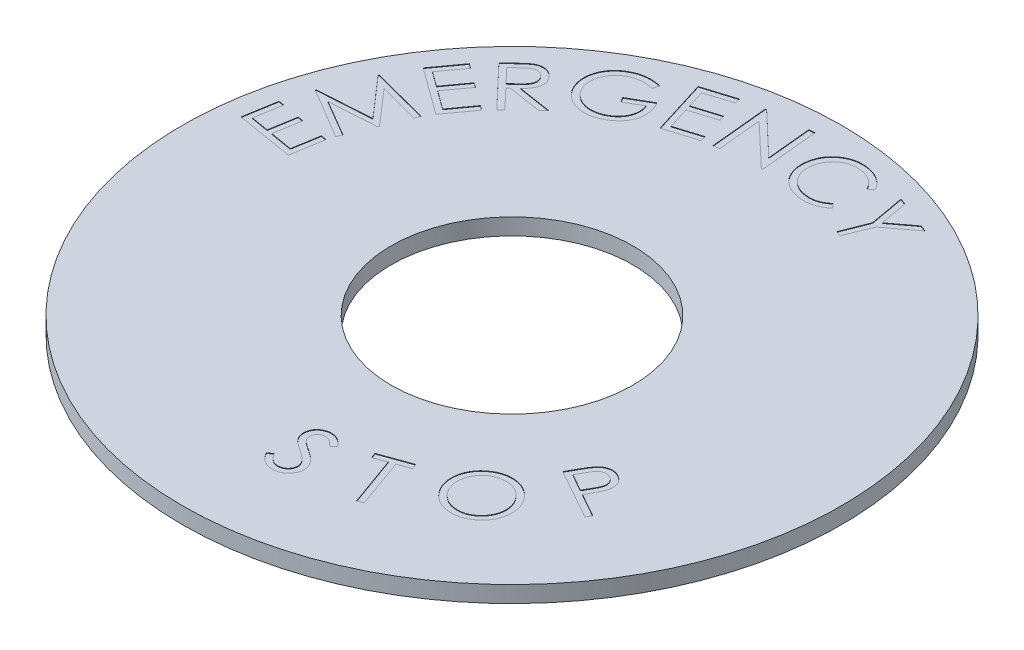
from build123d import *

# Parameters (mm, degrees)
SKETCH1_R           = 30
SKETCH1_R_2         = 11
BOSS_EXTRUDE1_DEPTH = 1.5
CUT_EXTRUDE1_DEPTH  = 0.05


with BuildPart() as part:
    # Sketch1 → Boss-Extrude1 (new body)
    with BuildSketch(Plane(origin=(0, 0, 0), x_dir=(1, 0, 0), z_dir=(0, 1, 0))):
        with Locations(Location((0, 0, 0), (0, 0, 270))):
            Circle(SKETCH1_R)
        with Locations(Location((0, 0, 0), (0, 0, 270))):
            Circle(SKETCH1_R_2, mode=Mode.SUBTRACT)
    extrude(amount=BOSS_EXTRUDE1_DEPTH)

    # Sketch2 → Cut-Extrude1 (cut)
    # profile 1 of 13: a face of its own
    with BuildSketch(Plane(origin=(0, 1.5, 0), x_dir=(1, 0, 0), z_dir=(0, 1, 0))):
        Polygon((8.532135657, 26.883621153), (9.095011258, 26.661014983), (9.545523745, 24.159345646), (11.565939744, 25.682607865), (12.129875374, 25.458941666), (9.578384655, 23.526508106), (8.656159094, 21.197623557), (8.175965785, 21.387368816), (9.098191346, 23.716253365), align=None)
    # profile 2 of 13: a face of its own
    with BuildSketch(Plane(origin=(0, 1.5, 0), x_dir=(1, 0, 0), z_dir=(0, 1, 0))):
        with BuildLine():
            Line((6.644591509, 26.400331876), (6.186658817, 26.146984854))
            add(Edge.make_bspline(
                [(6.186658817, 26.146984854), (6.163390178, 26.187509824), (6.117377826, 26.267645551), (6.041641982, 26.382926031), (5.960137749, 26.491876863), (5.873153275, 26.594978897), (5.780778697, 26.691274944), (5.683755691, 26.782219188), (5.581096008, 26.866852002), (5.47293275, 26.945164014), (5.360349437, 27.017265028), (5.243909582, 27.083493718), (5.122425962, 27.14085005), (4.998555558, 27.195482159), (4.868752237, 27.238459204), (4.73656702, 27.278521762), (4.599847021, 27.31045278), (4.506956954, 27.326223552), (4.459870956, 27.33421776)],
                knots=[0, 0, 0, 0, 1.031399129, 2.039530622, 3.042610309, 4.033331629, 5.015325043, 5.98660367, 6.967326175, 7.950248482, 8.932551624, 9.917452639, 10.904729031, 11.89716833, 12.903578405, 13.920392948, 14.945846682, 16, 16, 16, 16], degree=3))
            add(Edge.make_bspline(
                [(4.459870956, 27.33421776), (4.408006232, 27.341364414), (4.305284471, 27.355518869), (4.150787115, 27.362823247), (3.998239633, 27.363727581), (3.846928713, 27.353065288), (3.697397918, 27.33108713), (3.548710512, 27.302274498), (3.40201394, 27.261202236), (3.257525065, 27.211832272), (3.117066249, 27.153591067), (2.981743866, 27.088151793), (2.853872834, 27.013362763), (2.730953959, 26.933061372), (2.6159358, 26.843883886), (2.50677102, 26.747698819), (2.404094498, 26.644205069), (2.308842223, 26.532665403), (2.220856022, 26.415216327), (2.14118723, 26.291949602), (2.069999407, 26.163387524), (2.007397019, 26.029490294), (1.952990419, 25.890033558), (1.907945056, 25.745041855), (1.870147249, 25.595064279), (1.852591724, 25.492729475), (1.843718445, 25.441005286)],
                knots=[0, 0, 0, 0, 1.046126623, 2.071927885, 3.089107687, 4.09464415, 5.100602311, 6.109111688, 7.120190521, 8.143288616, 9.159928682, 10.158219063, 11.145654315, 12.119350492, 13.091405462, 14.052283009, 15.026286604, 16.00315477, 16.982191348, 17.95793515, 18.934931004, 19.917706367, 20.910709647, 21.924991144, 22.951205776, 24, 24, 24, 24], degree=3))
            add(Edge.make_bspline(
                [(1.843718445, 25.441005286), (1.833649981, 25.362689959), (1.813886071, 25.208960739), (1.811809339, 24.979519474), (1.828926397, 24.757176143), (1.869705982, 24.541149298), (1.932445341, 24.331984198), (2.016767701, 24.129045091), (2.123339766, 23.933312308), (2.251193546, 23.746783952), (2.396629151, 23.573101894), (2.556309843, 23.414566373), (2.731112573, 23.275396125), (2.919222276, 23.154105463), (3.121391978, 23.051550949), (3.337163015, 22.968456871), (3.56649791, 22.901399084), (3.725645028, 22.873180086), (3.806892858, 22.858773716)],
                knots=[0, 0, 0, 0, 1.044037952, 2.049396289, 3.029830331, 3.99087423, 4.952395713, 5.914496798, 6.893659041, 7.896142928, 8.90188173, 9.887142512, 10.868546028, 11.852929972, 12.844086366, 13.862579856, 14.908803687, 16, 16, 16, 16], degree=3))
            add(Edge.make_bspline(
                [(3.806892858, 22.858773716), (3.896852872, 22.847529011), (4.073852856, 22.825404596), (4.338767015, 22.828035078), (4.596774874, 22.855339211), (4.847203055, 22.914954401), (5.091239821, 23.000895426), (5.326770511, 23.11807199), (5.556900729, 23.260993436), (5.698824992, 23.376556776), (5.7711273, 23.435429699)],
                knots=[0, 0, 0, 0, 1.027360407, 2.021373366, 2.997348038, 3.96470063, 4.934499648, 5.925761345, 6.94329386, 8, 8, 8, 8], degree=3))
            Line((5.7711273, 23.435429699), (6.133657348, 23.061239327))
            add(Edge.make_bspline(
                [(6.133657348, 23.061239327), (6.094495707, 23.025776953), (6.016341037, 22.955004889), (5.89222927, 22.857880555), (5.76334481, 22.768442212), (5.629843508, 22.686479845), (5.490379831, 22.613511146), (5.346520662, 22.547595657), (5.197295222, 22.490507601), (5.044028064, 22.440207218), (4.88622636, 22.400556189), (4.725624667, 22.368648887), (4.562248859, 22.344660736), (4.395406344, 22.332728831), (4.225608003, 22.328392942), (4.052592121, 22.332615252), (3.876663247, 22.346034653), (3.759115627, 22.362736527), (3.69982989, 22.371160201)],
                knots=[0, 0, 0, 0, 0.967102922, 1.930041951, 2.883018821, 3.838364539, 4.796269897, 5.763264611, 6.734060963, 7.720214436, 8.715051999, 9.711066934, 10.717512287, 11.736214046, 12.771685601, 13.826560232, 14.903814673, 16, 16, 16, 16], degree=3))
            add(Edge.make_bspline(
                [(3.69982989, 22.371160201), (3.643574166, 22.380643146), (3.532779944, 22.399319565), (3.369844297, 22.434083776), (3.212918517, 22.476756002), (3.061135181, 22.525462812), (2.914876534, 22.580326402), (2.77453122, 22.642173205), (2.639344495, 22.709801223), (2.510573107, 22.785198173), (2.386956149, 22.866011269), (2.268674466, 22.95293344), (2.156970739, 23.04769357), (2.048883654, 23.146951244), (1.948859263, 23.254662107), (1.852652807, 23.367287817), (1.76240883, 23.486748873), (1.707877354, 23.571117357), (1.680473921, 23.613514635)],
                knots=[0, 0, 0, 0, 1.117505202, 2.200898149, 3.26208431, 4.301856884, 5.322632649, 6.32062461, 7.305009534, 8.282066429, 9.241981729, 10.197218819, 11.155260576, 12.110297018, 13.070062569, 14.032569815, 15.011317014, 16, 16, 16, 16], degree=3))
            add(Edge.make_bspline(
                [(1.680473921, 23.613514635), (1.637316981, 23.686231165), (1.551593502, 23.83066944), (1.449521036, 24.059925096), (1.368070528, 24.295307795), (1.309739356, 24.537808592), (1.274034393, 24.786950105), (1.258877746, 25.042603985), (1.267166431, 25.305559771), (1.290287156, 25.481783699), (1.302043432, 25.5713889)],
                knots=[0, 0, 0, 0, 0.994916343, 1.976221891, 2.948516844, 3.924294762, 4.908049019, 5.908240157, 6.936395502, 8, 8, 8, 8], degree=3))
            add(Edge.make_bspline(
                [(1.302043432, 25.5713889), (1.318444928, 25.664769885), (1.350697388, 25.848397429), (1.432281283, 26.11236918), (1.533670196, 26.362015313), (1.659348359, 26.596864568), (1.80961469, 26.815614552), (1.982558594, 27.019886596), (2.179578826, 27.207481345), (2.397249581, 27.3784053), (2.630521663, 27.529016256), (2.87569126, 27.655188133), (3.130097953, 27.754214843), (3.393755373, 27.82631061), (3.665981381, 27.873724006), (3.947224516, 27.89142458), (4.237226193, 27.886361491), (4.431760511, 27.861169535), (4.530892925, 27.848332009)],
                knots=[0, 0, 0, 0, 1.03055028, 2.026509114, 2.998766528, 3.958418939, 4.918017456, 5.880752175, 6.864957925, 7.872356755, 8.887448917, 9.88114261, 10.866968501, 11.851767112, 12.850267162, 13.867446085, 14.913275468, 16, 16, 16, 16], degree=3))
            add(Edge.make_bspline(
                [(4.530892925, 27.848332009), (4.591116983, 27.838518766), (4.710151016, 27.819122698), (4.883889537, 27.776699026), (5.052173161, 27.728337221), (5.214581207, 27.670870022), (5.371574907, 27.605458465), (5.522040229, 27.530850672), (5.667393125, 27.449328286), (5.805315272, 27.357782394), (5.937974429, 27.260989912), (6.062299787, 27.156531943), (6.179112283, 27.046115188), (6.288623041, 26.929682497), (6.389092317, 26.806190114), (6.483128483, 26.677440575), (6.569047237, 26.542263131), (6.619396757, 26.447667334), (6.644591509, 26.400331876)],
                knots=[0, 0, 0, 0, 1.099346405, 2.172879759, 3.220854363, 4.254116746, 5.275992697, 6.284204134, 7.279480553, 8.277442735, 9.265849739, 10.237789036, 11.201830771, 12.161508538, 13.116356535, 14.06916362, 15.033815154, 16, 16, 16, 16], degree=3))
        make_face()
    # profile 3 of 13: a face of its own
    with BuildSketch(Plane(origin=(0, 1.5, 0), x_dir=(1, 0, 0), z_dir=(0, 1, 0))):
        Polygon((-4.238878246, 22.538142677), (-4.74557229, 27.80118855), (-4.631089117, 27.811788844), (-0.745021408, 24.118646483), (-1.132992162, 28.147818158), (-0.613577765, 28.198699568), (-0.106883722, 22.935653695), (-0.225607012, 22.923993371), (-4.07775378, 26.568374381), (-3.695083174, 22.590084117), align=None)
    # profile 4 of 13: a face of its own
    with BuildSketch(Plane(origin=(0, 1.5, 0), x_dir=(1, 0, 0), z_dir=(0, 1, 0))):
        Polygon((-9.57981322, 26.524656527), (-6.702893482, 27.416141236), (-6.549189222, 26.921107515), (-8.923655034, 26.185447125), (-8.438161578, 24.615543613), (-6.084896353, 25.343783797), (-5.933312152, 24.852990194), (-8.286577376, 24.12475001), (-7.677060483, 22.156275451), (-5.323795258, 22.884515635), (-5.170090998, 22.389481914), (-8.025810149, 21.505417411), align=None)
    # profile 5 of 13: a face of its own
    with BuildSketch(Plane(origin=(0, 1.5, 0), x_dir=(1, 0, 0), z_dir=(0, 1, 0))):
        with BuildLine():
            Line((-11.370847809, 24.821771918), (-11.530912245, 24.280096904))
            add(Edge.make_bspline(
                [(-11.530912245, 24.280096904), (-11.630208429, 24.303121787), (-11.825620738, 24.348434159), (-12.121754208, 24.384242815), (-12.413516939, 24.391877836), (-12.699172555, 24.371593467), (-12.973951839, 24.326661565), (-13.233606915, 24.257337453), (-13.477589386, 24.167578647), (-13.627743857, 24.08748205), (-13.701852416, 24.04795047)],
                knots=[0, 0, 0, 0, 1.092950505, 2.150898184, 3.193721238, 4.219783463, 5.218794478, 6.176021253, 7.099777471, 8, 8, 8, 8], degree=3))
            add(Edge.make_bspline(
                [(-13.701852416, 24.04795047), (-13.745984128, 24.021240885), (-13.833735004, 23.968131922), (-13.959485228, 23.879775088), (-14.078206946, 23.783113344), (-14.190390747, 23.678996477), (-14.297369746, 23.568540302), (-14.396353818, 23.449566848), (-14.490494126, 23.324076739), (-14.57653608, 23.191420162), (-14.654321908, 23.054241733), (-14.724264041, 22.915491622), (-14.781147571, 22.773646434), (-14.829072232, 22.630320886), (-14.867562322, 22.48489958), (-14.895109035, 22.337154305), (-14.912128809, 22.187658055), (-14.918151652, 22.037119767), (-14.915166677, 21.887709038), (-14.902467403, 21.740374556), (-14.879896519, 21.596380291), (-14.849698217, 21.455222542), (-14.808797205, 21.317578843), (-14.759359065, 21.183156923), (-14.699501293, 21.05204781), (-14.653556882, 20.967598095), (-14.630438153, 20.925103915)],
                knots=[0, 0, 0, 0, 1.026724693, 2.041524977, 3.056617766, 4.072076069, 5.086949487, 6.115479782, 7.15091433, 8.208382873, 9.260597815, 10.289272421, 11.298989139, 12.299969949, 13.296367887, 14.291076002, 15.289260044, 16.289004312, 17.28808021, 18.262459607, 19.230445053, 20.187971873, 21.133931267, 22.086484427, 23.037139732, 24, 24, 24, 24], degree=3))
            add(Edge.make_bspline(
                [(-14.630438153, 20.925103915), (-14.605011633, 20.882576704), (-14.554398621, 20.797923742), (-14.465823334, 20.679755621), (-14.373422751, 20.565356348), (-14.270771047, 20.459225855), (-14.160843944, 20.359881408), (-14.043081696, 20.267035966), (-13.918450588, 20.180131932), (-13.786242568, 20.100997996), (-13.648849904, 20.030239493), (-13.507812634, 19.968313326), (-13.363078982, 19.917552071), (-13.215749932, 19.876308924), (-13.06540677, 19.843928259), (-12.911965351, 19.822961705), (-12.755418556, 19.812575564), (-12.596844539, 19.811631002), (-12.437482175, 19.81974006), (-12.279160218, 19.838853257), (-12.123106379, 19.8687944), (-11.968849772, 19.908323302), (-11.815961085, 19.956680223), (-11.665517168, 20.016711306), (-11.516300575, 20.085044799), (-11.420317191, 20.138940505), (-11.371907838, 20.166122879)],
                knots=[0, 0, 0, 0, 0.958270949, 1.907495738, 2.854871313, 3.802814364, 4.761451238, 5.720502657, 6.703132044, 7.699982976, 8.700088884, 9.69230836, 10.678547922, 11.665782704, 12.651571717, 13.652518914, 14.660078319, 15.685852261, 16.719889918, 17.746210769, 18.769520001, 19.792852082, 20.826595744, 21.870423192, 22.925944991, 24, 24, 24, 24], degree=3))
            add(Edge.make_bspline(
                [(-11.371907838, 20.166122879), (-11.314754057, 20.200512871), (-11.202166108, 20.268258148), (-11.046745714, 20.384383036), (-10.904749125, 20.508128342), (-10.775414524, 20.639271324), (-10.662432029, 20.781127497), (-10.56120977, 20.92989153), (-10.477335945, 21.088852147), (-10.404499538, 21.253441446), (-10.349245332, 21.423426847), (-10.308168624, 21.594534972), (-10.284729549, 21.76604242), (-10.278320244, 21.937882396), (-10.288885737, 22.109765674), (-10.317048784, 22.281820712), (-10.361310423, 22.453996274), (-10.403084685, 22.566362345), (-10.424241572, 22.623270983)],
                knots=[0, 0, 0, 0, 1.108634858, 2.183913709, 3.220863428, 4.23886201, 5.241844613, 6.2326715, 7.226368868, 8.226283237, 9.222219036, 10.194207827, 11.148995089, 12.09564801, 13.049331775, 14.007584046, 14.990926024, 16, 16, 16, 16], degree=3))
            Line((-10.424241572, 22.623270983), (-11.884962058, 21.779487596))
            Line((-11.884962058, 21.779487596), (-12.140429139, 22.221519848))
            Line((-12.140429139, 22.221519848), (-10.165594403, 23.362111461))
            add(Edge.make_bspline(
                [(-10.165594403, 23.362111461), (-10.118203239, 23.274500758), (-10.025517835, 23.103155878), (-9.913927841, 22.839256693), (-9.829849628, 22.577740617), (-9.771077134, 22.319267986), (-9.742740053, 22.062592641), (-9.739928802, 21.808526791), (-9.765958736, 21.556954731), (-9.817775011, 21.30955454), (-9.895978798, 21.069643107), (-9.999441377, 20.840023852), (-10.127744629, 20.62305469), (-10.27894767, 20.416389669), (-10.457437926, 20.22392226), (-10.658559022, 20.041896794), (-10.884356279, 19.872368008), (-11.048397877, 19.77288036), (-11.132341198, 19.721970569)],
                knots=[0, 0, 0, 0, 1.124380029, 2.199009427, 3.22999189, 4.223281972, 5.186989247, 6.140698461, 7.087260422, 8.037331507, 8.990038487, 9.931219192, 10.875625586, 11.831735876, 12.817366212, 13.834393406, 14.891816391, 16, 16, 16, 16], degree=3))
            add(Edge.make_bspline(
                [(-11.132341198, 19.721970569), (-11.185123564, 19.692590092), (-11.28927226, 19.634617353), (-11.447695598, 19.555594742), (-11.606364964, 19.48697769), (-11.764934265, 19.42743355), (-11.922579807, 19.376406551), (-12.080317411, 19.334525402), (-12.237984096, 19.303282679), (-12.395319152, 19.279394016), (-12.552514214, 19.265583227), (-12.709308098, 19.261693985), (-12.866123204, 19.26552589), (-13.022496156, 19.27971412), (-13.179015251, 19.301709776), (-13.335062632, 19.333790717), (-13.490793298, 19.374873192), (-13.593193822, 19.409057741), (-13.64461083, 19.426222372)],
                knots=[0, 0, 0, 0, 1.108531665, 2.187323822, 3.247400135, 4.279581155, 5.294673674, 6.28714524, 7.272729283, 8.242984357, 9.206389488, 10.16644987, 11.120028109, 12.08343324, 13.046336308, 14.019209808, 15.005412287, 16, 16, 16, 16], degree=3))
            add(Edge.make_bspline(
                [(-13.64461083, 19.426222372), (-13.722182421, 19.456051366), (-13.875749543, 19.515103305), (-14.094371914, 19.624911768), (-14.299492084, 19.750936155), (-14.487959318, 19.89681031), (-14.665813334, 20.055441419), (-14.826747998, 20.234042074), (-14.975230567, 20.428051833), (-15.060957067, 20.568123362), (-15.104271286, 20.638895983)],
                knots=[0, 0, 0, 0, 1.028089486, 2.03529077, 3.023128364, 4.002752264, 4.981165039, 5.968692826, 6.973660581, 8, 8, 8, 8], degree=3))
            add(Edge.make_bspline(
                [(-15.104271286, 20.638895983), (-15.134327191, 20.693288004), (-15.194064295, 20.801393946), (-15.270158564, 20.969000253), (-15.333909007, 21.139906979), (-15.387266627, 21.313149008), (-15.427562544, 21.490362879), (-15.456047262, 21.67027329), (-15.473100923, 21.853334551), (-15.478164948, 22.038143164), (-15.472335381, 22.223037451), (-15.452806511, 22.405702084), (-15.422392819, 22.585752848), (-15.378603073, 22.761890443), (-15.324538301, 22.93532355), (-15.257334669, 23.104725686), (-15.178976489, 23.271813155), (-15.087657111, 23.434340052), (-14.986321328, 23.592311376), (-14.873720971, 23.743264693), (-14.749949148, 23.886190322), (-14.617953717, 24.024028799), (-14.472675897, 24.15163927), (-14.319072547, 24.27373275), (-14.155389719, 24.389385547), (-14.039433212, 24.458247796), (-13.980640143, 24.49316281)],
                knots=[0, 0, 0, 0, 0.998533195, 1.984617757, 2.955074834, 3.928783478, 4.895911361, 5.873471317, 6.854505895, 7.848766302, 8.843205108, 9.825356852, 10.799164862, 11.775751028, 12.740290883, 13.716860537, 14.702568883, 15.704294709, 16.710918666, 17.717270239, 18.728114726, 19.748249309, 20.782061144, 21.833091341, 22.901319004, 24, 24, 24, 24], degree=3))
            add(Edge.make_bspline(
                [(-13.980640143, 24.49316281), (-13.932173281, 24.520573845), (-13.835825008, 24.575064808), (-13.687010101, 24.64644372), (-13.537229321, 24.711535072), (-13.385665881, 24.769132379), (-13.231839213, 24.817399864), (-13.077104211, 24.859244278), (-12.920589941, 24.89194742), (-12.762127777, 24.91736708), (-12.600896392, 24.936088874), (-12.435917275, 24.943683519), (-12.267558781, 24.945173732), (-12.095278591, 24.937475265), (-11.919138876, 24.92149627), (-11.739142565, 24.896965419), (-11.55552112, 24.864362921), (-11.432923682, 24.836088408), (-11.370847809, 24.821771918)],
                knots=[0, 0, 0, 0, 0.989431626, 1.966911508, 2.9317604, 3.891752793, 4.847132386, 5.79621589, 6.739734953, 7.687570866, 8.648138302, 9.622890639, 10.621488457, 11.639856986, 12.68664523, 13.764034514, 14.867843317, 16, 16, 16, 16], degree=3))
        make_face()
    # profile 6 of 13: a face of its own
    with BuildSketch(Plane(origin=(0, 1.5, 0), x_dir=(1, 0, 0), z_dir=(0, 1, 0))):
        with BuildLine():
            Line((-20.510597256, 19.31691732), (-19.753736278, 20.03455721))
            add(Edge.make_bspline(
                [(-19.753736278, 20.03455721), (-19.70288786, 20.082293353), (-19.605371521, 20.173841015), (-19.464995662, 20.304583786), (-19.334507006, 20.420445728), (-19.214428692, 20.521390285), (-19.10817596, 20.611656001), (-19.010895844, 20.685600815), (-18.926303517, 20.74791459), (-18.871297764, 20.781490656), (-18.846351129, 20.796718335)],
                knots=[0, 0, 0, 0, 1.410346305, 2.704741144, 3.879024781, 4.938458893, 5.877086594, 6.697409611, 7.409239099, 8, 8, 8, 8], degree=3))
            add(Edge.make_bspline(
                [(-18.846351129, 20.796718335), (-18.811980499, 20.815940244), (-18.744061759, 20.853924065), (-18.638891323, 20.901651337), (-18.532288603, 20.940295097), (-18.424388547, 20.968703035), (-18.315214629, 20.988141909), (-18.204877176, 20.997672532), (-18.093218903, 20.997276784), (-17.981171594, 20.989118625), (-17.869637408, 20.971331991), (-17.760756546, 20.942613563), (-17.654601782, 20.904094975), (-17.552027228, 20.855449345), (-17.452854882, 20.796173841), (-17.356013048, 20.728779091), (-17.263551982, 20.649418861), (-17.20539554, 20.59111678), (-17.175744825, 20.561391812)],
                knots=[0, 0, 0, 0, 1.030961999, 2.037252138, 3.020734604, 3.997095516, 4.955532717, 5.92148963, 6.893103216, 7.876759796, 8.861025533, 9.84633466, 10.821115699, 11.814517051, 12.814319335, 13.843785257, 14.900666819, 16, 16, 16, 16], degree=3))
            add(Edge.make_bspline(
                [(-17.175744825, 20.561391812), (-17.129313595, 20.509611927), (-17.038581851, 20.40842832), (-16.931280446, 20.238896876), (-16.849990135, 20.06223765), (-16.798474382, 19.878295456), (-16.773112728, 19.690499613), (-16.77867332, 19.500799051), (-16.814725474, 19.310830596), (-16.868608282, 19.154006567), (-16.927798079, 19.028091807), (-16.981730771, 18.929295924), (-17.046922035, 18.828876979), (-17.121276934, 18.725975948), (-17.205559031, 18.620637794), (-17.299814782, 18.512945399), (-17.404025267, 18.402525378), (-17.477978931, 18.329451665), (-17.516014256, 18.291868909)],
                knots=[0, 0, 0, 0, 1.277264306, 2.495915319, 3.673770048, 4.842265147, 5.995755017, 7.146477292, 8.316561591, 9.53936416, 10.18479628, 10.874083624, 11.607770921, 12.385142547, 13.208243868, 14.087967047, 15.016616723, 16, 16, 16, 16], degree=3))
            Line((-17.516014256, 18.291868909), (-14.471609876, 17.823335923))
            Line((-14.471609876, 17.823335923), (-14.942262921, 17.376003524))
            Line((-14.942262921, 17.376003524), (-17.983487213, 17.848776628))
            Line((-17.983487213, 17.848776628), (-18.200793236, 17.642070899))
            Line((-18.200793236, 17.642070899), (-16.523826756, 15.875001922))
            Line((-16.523826756, 15.875001922), (-16.903317275, 15.515651962))
            Line((-16.903317275, 15.515651962), (-20.510597256, 19.31691732))
        make_face()
        with BuildLine():
            Line((-19.778116954, 19.304196967), (-18.551662961, 18.012021153))
            Line((-18.551662961, 18.012021153), (-17.892324686, 18.627898223))
            add(Edge.make_bspline(
                [(-17.892324686, 18.627898223), (-17.861681764, 18.656968121), (-17.802571036, 18.713044458), (-17.720918602, 18.798604427), (-17.646811735, 18.879695809), (-17.580947546, 18.957054637), (-17.523025259, 19.03075359), (-17.473228312, 19.100807826), (-17.432977935, 19.168219507), (-17.388833985, 19.250582215), (-17.350021591, 19.354104041), (-17.323116877, 19.479878018), (-17.316134436, 19.607409579), (-17.332085106, 19.734101416), (-17.364151881, 19.8583675), (-17.416458871, 19.97599529), (-17.483739579, 20.087611985), (-17.541780607, 20.15304674), (-17.571135784, 20.186141412)],
                knots=[0, 0, 0, 0, 1.117100802, 2.154906778, 3.127533994, 4.02270898, 4.8416413, 5.606576793, 6.294232821, 6.917166079, 8.076743548, 9.204119621, 10.308439653, 11.43763523, 12.568917689, 13.690661798, 14.832015334, 16, 16, 16, 16], degree=3))
            add(Edge.make_bspline(
                [(-17.571135784, 20.186141412), (-17.601736958, 20.216113293), (-17.662357057, 20.275486778), (-17.767575374, 20.346483774), (-17.881327559, 20.401694622), (-18.00248957, 20.437592759), (-18.126081629, 20.45853777), (-18.249546915, 20.459719048), (-18.370737982, 20.441282911), (-18.470162584, 20.410265131), (-18.549840183, 20.373311499), (-18.615822567, 20.337969495), (-18.685406238, 20.29203739), (-18.761535378, 20.239370661), (-18.840247876, 20.175501522), (-18.927178395, 20.106555554), (-19.01609946, 20.025189721), (-19.077464763, 19.968504811), (-19.109238415, 19.939154566)],
                knots=[0, 0, 0, 0, 1.154888614, 2.28780312, 3.410380746, 4.557554851, 5.688739685, 6.78625268, 7.876772953, 8.987483632, 9.585365306, 10.247228072, 11.006979507, 11.835703442, 12.746369678, 13.74348885, 14.831626383, 16, 16, 16, 16], degree=3))
            Line((-19.109238415, 19.939154566), (-19.778116954, 19.304196967))
        make_face(mode=Mode.SUBTRACT)
    # profile 7 of 13: a face of its own
    with BuildSketch(Plane(origin=(0, 1.5, 0), x_dir=(1, 0, 0), z_dir=(0, 1, 0))):
        Polygon((-23.559513435, 15.474716319), (-21.793504488, 17.904303659), (-21.375852912, 17.601135256), (-22.83339331, 15.595559668), (-21.507296555, 14.631992961), (-20.062476509, 16.620608079), (-19.648005022, 16.318499706), (-21.092825067, 14.329884588), (-19.429638969, 13.121451095), (-17.984818924, 15.110066212), (-17.567167348, 14.806897809), (-19.320455943, 12.39427094), align=None)
    # profile 8 of 13: a face of its own
    with BuildSketch(Plane(origin=(0, 1.5, 0), x_dir=(1, 0, 0), z_dir=(0, 1, 0))):
        Polygon((-22.126823393, 6.07459252), (-26.709330405, 8.806288233), (-26.676469494, 8.885790436), (-21.849095696, 9.193198957), (-25.027063778, 12.828039702), (-24.993142838, 12.907541905), (-19.828679697, 11.566604739), (-20.02902525, 11.08641143), (-23.713687376, 12.067998636), (-20.949130752, 8.886850466), (-21.000012162, 8.764947087), (-25.243309772, 8.488279419), (-21.929657929, 6.545245565), align=None)
    # profile 9 of 13: a face of its own
    with BuildSketch(Plane(origin=(0, 1.5, 0), x_dir=(1, 0, 0), z_dir=(0, 1, 0))):
        Polygon((-27.986648215, 3.325128264), (-27.491614495, 6.285790324), (-26.981740363, 6.200987973), (-27.390911704, 3.756560222), (-25.776486957, 3.48625273), (-25.371555734, 5.909479894), (-24.86592172, 5.824677543), (-25.270852943, 3.40145038), (-23.244076768, 3.062240978), (-22.839145544, 5.485468142), (-22.330331442, 5.400665791), (-22.821125045, 2.461204319), align=None)
    # profile 10 of 13: a face of its own
    with BuildSketch(Plane(origin=(0, 1.5, 0), x_dir=(1, 0, 0), z_dir=(0, 1, 0))):
        with BuildLine():
            Line((-0.366573131, -22.009607039), (0.063798797, -21.713858841))
            add(Edge.make_bspline(
                [(0.063798797, -21.713858841), (0.107259543, -21.779973469), (0.190353537, -21.906380146), (0.326397752, -22.07617594), (0.465715979, -22.218564024), (0.607460673, -22.334676068), (0.753615148, -22.422155471), (0.902282652, -22.483210937), (1.055283481, -22.515419037), (1.157618185, -22.51459286), (1.208630528, -22.514181024)],
                knots=[0, 0, 0, 0, 1.293945615, 2.473936137, 3.553116955, 4.548030522, 5.463106938, 6.329407698, 7.167234346, 8, 8, 8, 8], degree=3))
            add(Edge.make_bspline(
                [(1.208630528, -22.514181024), (1.252294812, -22.510098069), (1.338863146, -22.502003247), (1.464463102, -22.4685075), (1.585685598, -22.42347248), (1.699425526, -22.361461068), (1.804266479, -22.288927665), (1.896163593, -22.204963534), (1.973155615, -22.111190756), (2.034434897, -22.007922629), (2.080921321, -21.899440652), (2.111930554, -21.787507658), (2.128998433, -21.673385885), (2.126706795, -21.596597448), (2.125555942, -21.558034522)],
                knots=[0, 0, 0, 0, 1.069486372, 2.120352006, 3.16389048, 4.221962134, 5.275518125, 6.271238053, 7.252602134, 8.228065453, 9.194783485, 10.126658966, 11.0592137, 12, 12, 12, 12], degree=3))
            add(Edge.make_bspline(
                [(2.125555942, -21.558034522), (2.120721706, -21.514266153), (2.110943579, -21.425736606), (2.067427995, -21.296352892), (2.003366094, -21.169327158), (1.945542804, -21.091531359), (1.915670124, -21.051340479)],
                knots=[0, 0, 0, 0, 0.946584278, 1.914640176, 2.922661007, 4, 4, 4, 4], degree=3))
            add(Edge.make_bspline(
                [(1.915670124, -21.051340479), (1.891305512, -21.022385505), (1.840224811, -20.961681059), (1.752173673, -20.873085113), (1.65278776, -20.779727648), (1.53963018, -20.683234246), (1.41367798, -20.582487118), (1.27373316, -20.479454046), (1.121638006, -20.371675476), (1.014833754, -20.300564499), (0.959523623, -20.263738649)],
                knots=[0, 0, 0, 0, 0.730322528, 1.531129876, 2.409536706, 3.362574168, 4.401336892, 5.522865604, 6.717180036, 8, 8, 8, 8], degree=3))
            add(Edge.make_bspline(
                [(0.959523623, -20.263738649), (0.904661148, -20.227132708), (0.799738024, -20.157124754), (0.651259426, -20.054845733), (0.519909936, -19.958654786), (0.40297538, -19.872710782), (0.303045825, -19.792978478), (0.219049283, -19.721077758), (0.150685424, -19.657036636), (0.112681051, -19.61487157), (0.095599678, -19.595920139)],
                knots=[0, 0, 0, 0, 1.446283586, 2.765981501, 3.953171426, 5.016246924, 5.948013901, 6.755663566, 7.440722931, 8, 8, 8, 8], degree=3))
            add(Edge.make_bspline(
                [(0.095599678, -19.595920139), (0.071460762, -19.566236839), (0.023877057, -19.507723798), (-0.038558788, -19.415021532), (-0.093297375, -19.320323395), (-0.138462354, -19.222926807), (-0.176408251, -19.123222779), (-0.204796328, -19.021042554), (-0.224046695, -18.915948792), (-0.230706938, -18.845131491), (-0.234069459, -18.809378339)],
                knots=[0, 0, 0, 0, 1.057497901, 2.08458682, 3.086836792, 4.079082921, 5.049980607, 6.033772066, 7.007321006, 8, 8, 8, 8], degree=3))
            add(Edge.make_bspline(
                [(-0.234069459, -18.809378339), (-0.23563988, -18.753136118), (-0.238734318, -18.642313597), (-0.216158968, -18.47874431), (-0.175074057, -18.321378711), (-0.11224082, -18.171510007), (-0.029546682, -18.031952842), (0.07059947, -17.904257726), (0.189980799, -17.791973469), (0.325665174, -17.695476181), (0.472707625, -17.613460893), (0.630366755, -17.553439191), (0.794935894, -17.510292261), (0.90838827, -17.499401242), (0.9658838, -17.493881878)],
                knots=[0, 0, 0, 0, 1.018597195, 2.0070955, 2.981396543, 3.960571644, 4.942801639, 5.914297476, 6.893137214, 7.90297373, 8.926554818, 9.936594515, 10.954304922, 12, 12, 12, 12], degree=3))
            add(Edge.make_bspline(
                [(0.9658838, -17.493881878), (1.027064981, -17.492235456), (1.148517031, -17.488967107), (1.32951684, -17.513228504), (1.505150005, -17.561702918), (1.647824605, -17.620044851), (1.760256111, -17.680514479), (1.847043545, -17.735764619), (1.935597717, -17.800907123), (2.024894988, -17.876646943), (2.117937217, -17.960030273), (2.210270784, -18.05514428), (2.306651141, -18.157878762), (2.368991286, -18.231717127), (2.401163581, -18.269823385)],
                knots=[0, 0, 0, 0, 1.293200228, 2.567158959, 3.845605595, 5.139389012, 5.818311698, 6.544132576, 7.314108882, 8.141996047, 9.020444958, 9.956033445, 10.945156536, 12, 12, 12, 12], degree=3))
            Line((2.401163581, -18.269823385), (1.99199224, -18.621753139))
            add(Edge.make_bspline(
                [(1.99199224, -18.621753139), (1.965975195, -18.59195649), (1.915616439, -18.534281909), (1.840622991, -18.452705797), (1.768653805, -18.379349386), (1.699424813, -18.314591721), (1.634114449, -18.257091743), (1.57153731, -18.20816091), (1.512260391, -18.167366807), (1.437514082, -18.125519914), (1.344875581, -18.083529952), (1.229218905, -18.052605768), (1.110292363, -18.033832959), (1.029903623, -18.036384936), (0.989204446, -18.03767695)],
                knots=[0, 0, 0, 0, 1.177076423, 2.278356496, 3.296975106, 4.234253806, 5.098759415, 5.885392342, 6.596978033, 7.237336099, 8.433050103, 9.611628378, 10.790816234, 12, 12, 12, 12], degree=3))
            add(Edge.make_bspline(
                [(0.989204446, -18.03767695), (0.938262197, -18.042677296), (0.840015041, -18.052320957), (0.702727601, -18.100274654), (0.579940611, -18.167925842), (0.477886382, -18.261128124), (0.39614622, -18.368618833), (0.337889567, -18.487904252), (0.307293414, -18.618087808), (0.308201191, -18.707470928), (0.308665584, -18.753196782)],
                knots=[0, 0, 0, 0, 1.109823549, 2.140404258, 3.138574213, 4.140082589, 5.122382946, 6.060885758, 7.008004473, 8, 8, 8, 8], degree=3))
            add(Edge.make_bspline(
                [(0.308665584, -18.753196782), (0.311137825, -18.781570525), (0.316068345, -18.838157762), (0.336216312, -18.921478561), (0.363706018, -19.003125206), (0.399959225, -19.084556187), (0.450170702, -19.164860259), (0.513626718, -19.24724866), (0.592259593, -19.331812148), (0.652375648, -19.38614761), (0.683915984, -19.414655115)],
                knots=[0, 0, 0, 0, 0.872181925, 1.739437944, 2.619924, 3.512063859, 4.465265114, 5.516212279, 6.696862263, 8, 8, 8, 8], degree=3))
            add(Edge.make_bspline(
                [(0.683915984, -19.414655115), (0.695464476, -19.424339952), (0.723102897, -19.447518183), (0.77468628, -19.48363011), (0.840017325, -19.53096744), (0.922421536, -19.58516031), (1.018178228, -19.651738937), (1.130999271, -19.725089204), (1.257907118, -19.809467243), (1.348459534, -19.867432675), (1.396255728, -19.898028513)],
                knots=[0, 0, 0, 0, 0.419872277, 1.004859108, 1.753518332, 2.668476273, 3.752805426, 5.003692783, 6.418462084, 8, 8, 8, 8], degree=3))
            add(Edge.make_bspline(
                [(1.396255728, -19.898028513), (1.453642961, -19.935968554), (1.564997935, -20.009587931), (1.724249284, -20.120075395), (1.868385699, -20.230042608), (2.000444568, -20.335384449), (2.117948661, -20.4393465), (2.222589889, -20.539898758), (2.312872096, -20.638358766), (2.413365366, -20.763981991), (2.516754204, -20.920692293), (2.608894486, -21.114830265), (2.67251524, -21.311304599), (2.687427314, -21.445245713), (2.694791719, -21.51139323)],
                knots=[0, 0, 0, 0, 1.151888073, 2.235139423, 3.244458884, 4.186904782, 5.062926043, 5.870420625, 6.615818299, 7.297700382, 8.562860364, 9.748425653, 10.88804828, 12, 12, 12, 12], degree=3))
            add(Edge.make_bspline(
                [(2.694791719, -21.51139323), (2.696493486, -21.558403185), (2.699864391, -21.651521707), (2.687461088, -21.789703455), (2.662650534, -21.924286823), (2.621094313, -22.054126879), (2.568760553, -22.181295922), (2.499460138, -22.30316408), (2.419172285, -22.42293604), (2.32404228, -22.535596311), (2.220302939, -22.641518892), (2.107413781, -22.734830262), (1.988579845, -22.816222417), (1.861978462, -22.883052441), (1.72960784, -22.938908868), (1.589596118, -22.979351898), (1.443736351, -23.010561081), (1.343408647, -23.018802692), (1.292372849, -23.022995126)],
                knots=[0, 0, 0, 0, 0.985101986, 1.951315243, 2.901241313, 3.847580778, 4.803521556, 5.778212514, 6.780617436, 7.821778404, 8.863913491, 9.884215073, 10.886619996, 11.877274086, 12.879925202, 13.892185351, 14.927773701, 16, 16, 16, 16], degree=3))
            add(Edge.make_bspline(
                [(1.292372849, -23.022995126), (1.252807811, -23.02453329), (1.174372513, -23.027582607), (1.057358617, -23.02372716), (0.943019884, -23.009476132), (0.830823465, -22.988045443), (0.720741876, -22.95993954), (0.613085937, -22.922422324), (0.507884843, -22.876656678), (0.404542227, -22.822487275), (0.303173515, -22.758317923), (0.203437135, -22.683693734), (0.104393748, -22.598574093), (0.007576421, -22.502065836), (-0.088877764, -22.395002771), (-0.183218587, -22.276799233), (-0.277356001, -22.147952685), (-0.336292964, -22.056561355), (-0.366573131, -22.009607039)],
                knots=[0, 0, 0, 0, 0.925374135, 1.834498347, 2.73294237, 3.615761421, 4.50320461, 5.386062295, 6.277531929, 7.182670549, 8.110694714, 9.078691094, 10.091896301, 11.160671008, 12.271847077, 13.458545915, 14.694271792, 16, 16, 16, 16], degree=3))
        make_face()
    # profile 11 of 13: a face of its own
    with BuildSketch(Plane(origin=(0, 1.5, 0), x_dir=(1, 0, 0), z_dir=(0, 1, 0))):
        Polygon((4.811518528, -17.588489601), (4.63767371, -17.105116203), (7.365129306, -16.123528997), (7.538974124, -16.606902395), (6.430183392, -17.005473442), (8.045668168, -21.492577809), (7.538974124, -21.674902862), (5.923489348, -17.187798495), align=None)
    # profile 12 of 13: a face of its own
    with BuildSketch(Plane(origin=(0, 1.5, 0), x_dir=(1, 0, 0), z_dir=(0, 1, 0))):
        with BuildLine():
            add(Edge.make_bspline(
                [(11.026979561, -13.466332189), (11.103640907, -13.406184007), (11.254014773, -13.288201279), (11.494752421, -13.139198754), (11.741107698, -13.016900184), (11.993901846, -12.920061108), (12.253866279, -12.852368056), (12.519853778, -12.810955149), (12.792237157, -12.795867369), (13.067653793, -12.809255309), (13.34056465, -12.846857285), (13.605025057, -12.909081788), (13.857357997, -12.997802497), (14.098291908, -13.110219176), (14.326170152, -13.248964164), (14.541061352, -13.413020562), (14.746544759, -13.599164885), (14.868896863, -13.740927703), (14.931067769, -13.812961796)],
                knots=[0, 0, 0, 0, 1.068618705, 2.096132362, 3.100141999, 4.083117061, 5.061208631, 6.042285317, 7.032513895, 8.049460311, 9.063364109, 10.051799508, 11.025469589, 11.993363091, 12.964234352, 13.94678107, 14.956695665, 16, 16, 16, 16], degree=3))
            add(Edge.make_bspline(
                [(14.931067769, -13.812961796), (14.989023419, -13.887200783), (15.103247073, -14.033516948), (15.247837282, -14.267778381), (15.364919366, -14.509943332), (15.457316802, -14.759281636), (15.521359432, -15.016754847), (15.56171625, -15.281495394), (15.572119893, -15.553605698), (15.558670505, -15.829650848), (15.519599233, -16.10280322), (15.457616198, -16.367679678), (15.369090556, -16.61977695), (15.256387047, -16.859708964), (15.118325298, -17.086431476), (14.957634943, -17.301829848), (14.771606487, -17.504543895), (14.631281489, -17.625815836), (14.560057486, -17.687369181)],
                knots=[0, 0, 0, 0, 1.042504097, 2.054650888, 3.041773218, 4.017371398, 4.99401287, 5.975253492, 6.977983345, 8.004529956, 9.032239505, 10.029824686, 11.012507868, 11.985819459, 12.960302518, 13.947238666, 14.958091001, 16, 16, 16, 16], degree=3))
            add(Edge.make_bspline(
                [(14.560057486, -17.687369181), (14.48472829, -17.745984253), (14.336470318, -17.861346585), (14.100016422, -18.00843304), (13.855932613, -18.127219324), (13.605524612, -18.222363795), (13.346734189, -18.287109722), (13.081331782, -18.328599337), (12.808867394, -18.340035076), (12.532741703, -18.327953364), (12.259922935, -18.288736792), (11.995983048, -18.226413211), (11.745234899, -18.139339597), (11.50685508, -18.028271278), (11.281103047, -17.893128281), (11.068764324, -17.733197504), (10.86838814, -17.549955548), (10.748641031, -17.411951167), (10.68777016, -17.341799603)],
                knots=[0, 0, 0, 0, 1.057572212, 2.081444106, 3.079955049, 4.062855796, 5.045163212, 6.031771973, 7.035608141, 8.062920726, 9.091583993, 10.086284766, 11.064891386, 12.028688028, 12.996678079, 13.975911609, 14.971098123, 16, 16, 16, 16], degree=3))
            add(Edge.make_bspline(
                [(10.68777016, -17.341799603), (10.6489715, -17.292805124), (10.571951822, -17.195545605), (10.468384954, -17.042229887), (10.374273396, -16.885257212), (10.292989255, -16.723104851), (10.222549335, -16.556198805), (10.162252805, -16.385355411), (10.112970563, -16.209426134), (10.07669999, -16.029669184), (10.049659593, -15.848577146), (10.036139453, -15.667902301), (10.033968023, -15.48876005), (10.043106093, -15.310903026), (10.065752388, -15.134589036), (10.099770358, -14.960020847), (10.145613012, -14.7869248), (10.202396506, -14.615692827), (10.27113528, -14.449037053), (10.34996031, -14.288417734), (10.437825706, -14.133952105), (10.537058412, -13.987089227), (10.643660838, -13.845064865), (10.762316617, -13.711788989), (10.888950856, -13.583778941), (10.980809553, -13.505617622), (11.026979561, -13.466332189)],
                knots=[0, 0, 0, 0, 1.039024793, 2.062580368, 3.074395898, 4.080907747, 5.076276609, 6.085443783, 7.092007092, 8.11192958, 9.133273045, 10.135159916, 11.122447543, 12.111080808, 13.09432047, 14.0762071, 15.066811824, 16.070265665, 17.074218356, 18.06236251, 19.044143632, 20.026909066, 21.008268037, 21.995013395, 22.99225384, 24, 24, 24, 24], degree=3))
        make_face()
        with BuildLine():
            add(Edge.make_bspline(
                [(11.37148911, -13.846882736), (11.334970638, -13.878165593), (11.262194143, -13.940508197), (11.161955076, -14.042879476), (11.067999379, -14.150085065), (10.982023559, -14.263865927), (10.903433277, -14.383932075), (10.8322529, -14.510365271), (10.768975235, -14.642972684), (10.712541126, -14.780023393), (10.666654356, -14.920967736), (10.62781263, -15.062581717), (10.600323827, -15.205451128), (10.582646031, -15.348897019), (10.572386483, -15.492941087), (10.573907666, -15.637472586), (10.584511798, -15.782282823), (10.604631163, -15.927114367), (10.634115218, -16.070944714), (10.673438934, -16.212260692), (10.722297459, -16.350396522), (10.780958662, -16.485584675), (10.848966299, -16.617775068), (10.925208784, -16.747929415), (11.012337892, -16.87388682), (11.076345175, -16.954529761), (11.108601824, -16.995169996)],
                knots=[0, 0, 0, 0, 0.984844531, 1.962665147, 2.932519679, 3.904129115, 4.882056937, 5.870779138, 6.874627332, 7.891033197, 8.905270783, 9.909823643, 10.898068597, 11.883179209, 12.86996448, 13.854622712, 14.841912481, 15.843277354, 16.848560457, 17.848039124, 18.846415859, 19.848408679, 20.865123921, 21.890744944, 22.937035023, 24, 24, 24, 24], degree=3))
            add(Edge.make_bspline(
                [(11.108601824, -16.995169996), (11.158663839, -17.053185466), (11.256969192, -17.167108791), (11.422691551, -17.316553858), (11.594839808, -17.449443231), (11.779154129, -17.560012654), (11.972252101, -17.652195407), (12.176533742, -17.721306192), (12.389035206, -17.774440878), (12.609426583, -17.803947657), (12.831108012, -17.814710448), (13.049801773, -17.805570153), (13.262310245, -17.775070265), (13.468105773, -17.72242174), (13.667672018, -17.650353774), (13.859929481, -17.555903792), (14.047173693, -17.442776879), (14.163080727, -17.351888193), (14.221908114, -17.305758604)],
                knots=[0, 0, 0, 0, 1.055006771, 2.071686705, 3.068918345, 4.047611683, 5.027757448, 6.01172973, 7.014367358, 8.04177616, 9.070326611, 10.069470285, 11.053490755, 12.02305713, 12.99192634, 13.97189067, 14.970654603, 16, 16, 16, 16], degree=3))
            add(Edge.make_bspline(
                [(14.221908114, -17.305758604), (14.260194508, -17.273066458), (14.336117223, -17.208237254), (14.440942556, -17.102348543), (14.538907819, -16.992424081), (14.627971032, -16.87621646), (14.709911895, -16.755469037), (14.783240571, -16.629008777), (14.847741279, -16.49698741), (14.905127057, -16.360977294), (14.9524902, -16.221293443), (14.990719173, -16.0803776), (15.019476904, -15.938761731), (15.038959071, -15.796448831), (15.047089867, -15.653282404), (15.045969916, -15.509541169), (15.03581797, -15.365291043), (15.01369295, -15.221063862), (14.985016095, -15.077741298), (14.945147433, -14.936917661), (14.896627801, -14.799027196), (14.83785693, -14.664425308), (14.771226979, -14.53237963), (14.69416545, -14.403859159), (14.609051351, -14.27776803), (14.545402012, -14.197705377), (14.513416193, -14.157471345)],
                knots=[0, 0, 0, 0, 1.027790398, 2.038129688, 3.040136248, 4.033189732, 5.025928527, 6.018588634, 7.015828482, 8.025007396, 9.031395948, 10.025707192, 11.005057996, 11.980732925, 12.956648008, 13.930880775, 14.914952648, 15.906930532, 16.908937092, 17.898207702, 18.893330404, 19.892057405, 20.89575161, 21.911821655, 22.950623912, 24, 24, 24, 24], degree=3))
            add(Edge.make_bspline(
                [(14.513416193, -14.157471345), (14.479903409, -14.118588956), (14.413432855, -14.04146812), (14.307621906, -13.933445351), (14.196864003, -13.834180576), (14.081111426, -13.744321754), (13.961359512, -13.661810361), (13.835455457, -13.590405553), (13.706545109, -13.524927045), (13.572550894, -13.470471526), (13.436287168, -13.423113785), (13.296708725, -13.387685704), (13.155946918, -13.359860856), (13.013248252, -13.341321107), (12.869047281, -13.334836415), (12.72313856, -13.334962896), (12.575620055, -13.347711024), (12.427162871, -13.367013588), (12.280298838, -13.39687885), (12.136932215, -13.43506723), (11.997472524, -13.481425476), (11.863363414, -13.538085452), (11.732823237, -13.601416368), (11.608284551, -13.675370176), (11.486168421, -13.755348704), (11.40990007, -13.816224111), (11.37148911, -13.846882736)],
                knots=[0, 0, 0, 0, 1.051701139, 2.085984767, 3.09618903, 4.097034158, 5.087135321, 6.073257068, 7.060892881, 8.047864917, 9.034757269, 10.014719111, 10.995964116, 11.973998057, 12.960040052, 13.952045664, 14.961652918, 15.991822454, 17.018499924, 18.030156301, 19.030765674, 20.027200847, 21.011619813, 22.001376727, 22.993435188, 24, 24, 24, 24], degree=3))
        make_face(mode=Mode.SUBTRACT)
    # profile 13 of 13: a face of its own
    with BuildSketch(Plane(origin=(0, 1.5, 0), x_dir=(1, 0, 0), z_dir=(0, 1, 0))):
        with BuildLine():
            Line((14.620998834, -9.987613983), (15.135113084, -9.074928687))
            add(Edge.make_bspline(
                [(15.135113084, -9.074928687), (15.170608269, -9.012276242), (15.238663666, -8.892151866), (15.339152451, -8.721892554), (15.432627309, -8.568988373), (15.518274826, -8.432915604), (15.597482181, -8.313894432), (15.67079081, -8.212465854), (15.735348587, -8.126593698), (15.779630312, -8.078220687), (15.799751505, -8.056240452)],
                knots=[0, 0, 0, 0, 1.418299168, 2.719324099, 3.893834521, 4.948053702, 5.886160741, 6.708959949, 7.413363712, 8, 8, 8, 8], degree=3))
            add(Edge.make_bspline(
                [(15.799751505, -8.056240452), (15.826540145, -8.028942654), (15.879326461, -7.975153052), (15.965071083, -7.902855601), (16.053970907, -7.837766084), (16.147417624, -7.781638569), (16.24466358, -7.733702172), (16.34518984, -7.693220937), (16.449939653, -7.661578862), (16.557491685, -7.636917983), (16.667809193, -7.621944939), (16.77927123, -7.617744383), (16.891069677, -7.624149134), (17.003200364, -7.641297257), (17.115402219, -7.669330617), (17.228558578, -7.70609538), (17.3411134, -7.755636883), (17.414767491, -7.794652492), (17.452337309, -7.814553753)],
                knots=[0, 0, 0, 0, 1.013107166, 1.996301304, 2.968418487, 3.930379891, 4.881016965, 5.839142199, 6.798867701, 7.777995435, 8.760654307, 9.74460624, 10.72944895, 11.724037552, 12.746063732, 13.79137619, 14.873415005, 16, 16, 16, 16], degree=3))
            add(Edge.make_bspline(
                [(17.452337309, -7.814553753), (17.489450975, -7.836236255), (17.561798224, -7.878502877), (17.662233591, -7.950478881), (17.753737604, -8.026917723), (17.836578258, -8.107990087), (17.908875351, -8.194841793), (17.973234144, -8.285048367), (18.027624852, -8.380955631), (18.071490662, -8.481856077), (18.108246691, -8.585372685), (18.133171734, -8.692163722), (18.150142317, -8.800574072), (18.159331577, -8.911529427), (18.15626877, -9.024993595), (18.145940593, -9.140876073), (18.125886548, -9.258976085), (18.105219978, -9.337250167), (18.094715114, -9.37703706)],
                knots=[0, 0, 0, 0, 1.120973334, 2.185161012, 3.219171486, 4.22961108, 5.20460658, 6.163783168, 7.117450266, 8.07503059, 9.031323097, 9.979403868, 10.931242263, 11.892852471, 12.879459596, 13.888552498, 14.926746443, 16, 16, 16, 16], degree=3))
            add(Edge.make_bspline(
                [(18.094715114, -9.37703706), (18.08491042, -9.409344901), (18.063534126, -9.479782788), (18.018342541, -9.591194875), (17.963432473, -9.718696514), (17.898102468, -9.862583183), (17.817017756, -10.01997081), (17.727858844, -10.194843512), (17.625672755, -10.384951264), (17.552193449, -10.515980658), (17.513819013, -10.584410524)],
                knots=[0, 0, 0, 0, 0.60350506, 1.315767933, 2.147958969, 3.086659814, 4.140709958, 5.313527612, 6.596994604, 8, 8, 8, 8], degree=3))
            Line((17.513819013, -10.584410524), (17.329373901, -10.910899573))
            Line((17.329373901, -10.910899573), (19.458972926, -12.110852832))
            Line((19.458972926, -12.110852832), (19.201385787, -12.568785524))
            Line((19.201385787, -12.568785524), (14.620998834, -9.987613983))
        make_face()
        with BuildLine():
            Line((15.323798313, -9.780908254), (16.880981473, -10.658612581))
            Line((16.880981473, -10.658612581), (17.327253842, -9.889031251))
            add(Edge.make_bspline(
                [(17.327253842, -9.889031251), (17.348219237, -9.850936326), (17.388767177, -9.777259169), (17.445460901, -9.669689589), (17.492945953, -9.567399824), (17.534356765, -9.47199668), (17.569923324, -9.383679021), (17.596430977, -9.300969669), (17.617113893, -9.225062128), (17.633962648, -9.132545418), (17.640783921, -9.022240692), (17.631308844, -8.893538285), (17.597907339, -8.769741087), (17.547384144, -8.651479067), (17.479597464, -8.541656106), (17.397142441, -8.442360152), (17.29852187, -8.356801995), (17.224060649, -8.310716344), (17.186269935, -8.287326857)],
                knots=[0, 0, 0, 0, 1.138241406, 2.201405885, 3.182029201, 4.08924342, 4.923972003, 5.672749803, 6.361482206, 6.981931076, 8.131204566, 9.244944372, 10.344188031, 11.471213474, 12.600665239, 13.71028812, 14.837920633, 16, 16, 16, 16], degree=3))
            add(Edge.make_bspline(
                [(17.186269935, -8.287326857), (17.147873576, -8.267893732), (17.071750675, -8.229366487), (16.949700161, -8.190461804), (16.822927676, -8.173328675), (16.694949687, -8.171885472), (16.568726016, -8.188461152), (16.44908865, -8.223841138), (16.336824111, -8.276014263), (16.251205168, -8.336452009), (16.185075864, -8.395568552), (16.13365667, -8.449996828), (16.078942648, -8.512839024), (16.023319218, -8.586215531), (15.965016386, -8.66896862), (15.90473965, -8.761353808), (15.842154466, -8.863143525), (15.800971977, -8.934890995), (15.779610947, -8.972105837)],
                knots=[0, 0, 0, 0, 1.156284892, 2.292398645, 3.425368073, 4.584811953, 5.725883201, 6.835494909, 7.928046008, 9.040583955, 9.639594676, 10.311715199, 11.052852243, 11.879695622, 12.786702675, 13.775139237, 14.845982412, 16, 16, 16, 16], degree=3))
            Line((15.779610947, -8.972105837), (15.323798313, -9.780908254))
        make_face(mode=Mode.SUBTRACT)
    extrude(amount=-CUT_EXTRUDE1_DEPTH, mode=Mode.SUBTRACT)


solid = part.part
